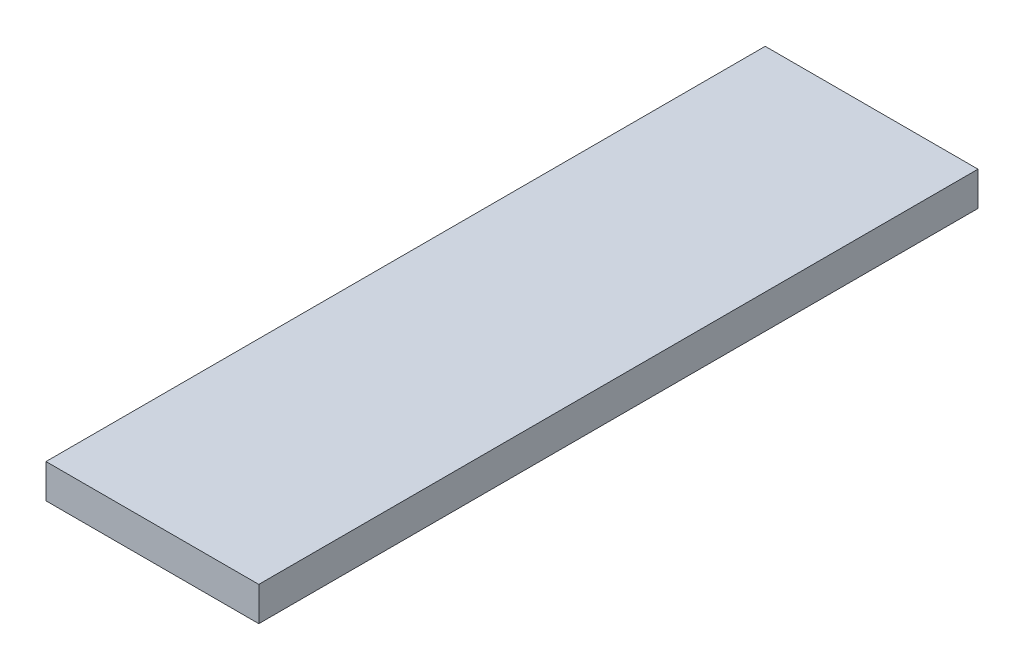
from build123d import *

# Parameters (mm, degrees)
SKETCH_1_W      = 200
SKETCH_1_H      = 32
EXTRUDE_1_DEPTH = 676


with BuildPart() as part:
    # Эскиз1 → Бобышка-Вытянуть1 (new body)
    with BuildSketch(Plane.XY):
        with Locations((-100, 16)):
            Rectangle(SKETCH_1_W, SKETCH_1_H)
    extrude(amount=EXTRUDE_1_DEPTH)


solid = part.part
